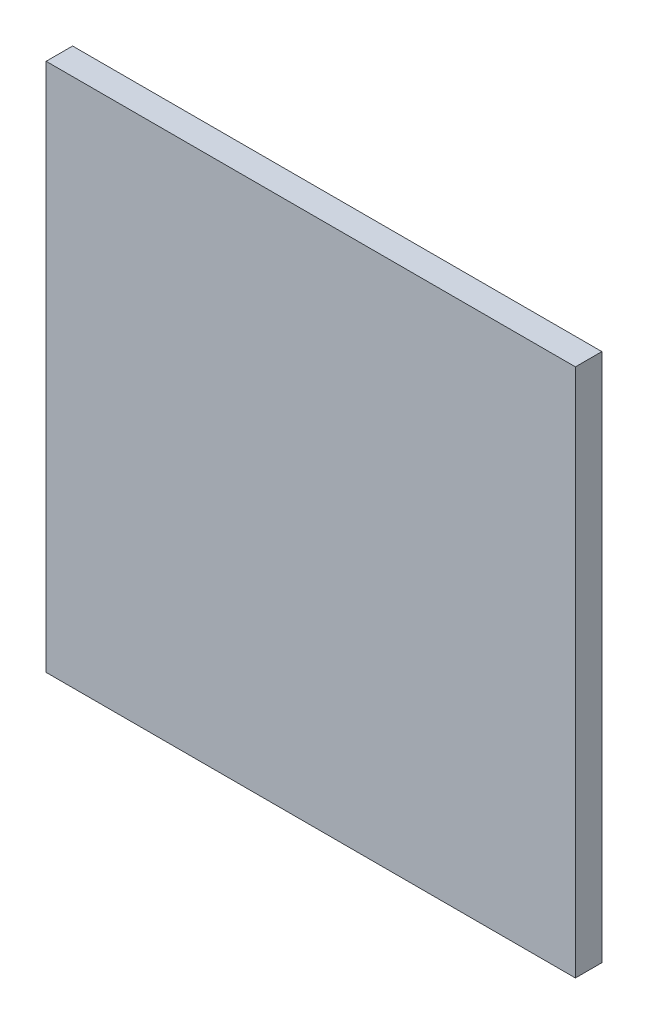
from build123d import *

# Parameters (mm, degrees)
CROQUIS1_W              = 100
CROQUIS1_H              = 100
SALIENTE_EXTRUIR1_DEPTH = 5


with BuildPart() as part:
    # Croquis1 → Saliente-Extruir1 (new body)
    with BuildSketch(Plane.XY):
        with Locations((-50, -50)):
            Rectangle(CROQUIS1_W, CROQUIS1_H)
    extrude(amount=SALIENTE_EXTRUIR1_DEPTH)


solid = part.part
